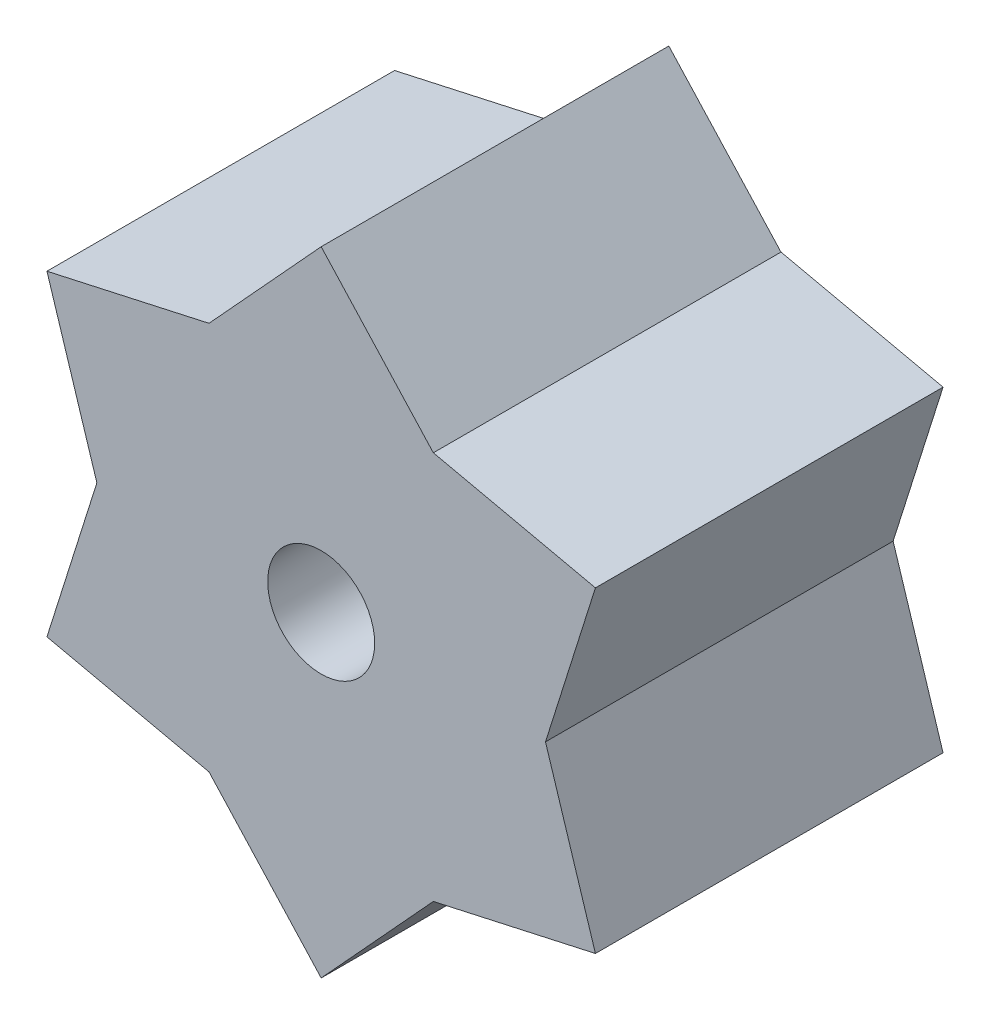
from build123d import *

# Parameters (mm, degrees)
SKETCH1_R           = 1
BOSS_EXTRUDE1_DEPTH = 6.5


with BuildPart() as part:
    # Sketch1 → Boss-Extrude1 (new body)
    with BuildSketch(Plane.XY):
        Polygon((0, -5.920748932), (2.09705825, -3.632211436), (5.127518984, -2.960374466), (4.194116501, 0), (5.127518984, 2.960374466), (2.09705825, 3.632211436), (0, 5.920748932), (-2.09705825, 3.632211436), (-5.127518984, 2.960374466), (-4.194116501, 0), (-5.127518984, -2.960374466), (-2.09705825, -3.632211436), align=None)
        Circle(SKETCH1_R, mode=Mode.SUBTRACT)
    extrude(amount=-BOSS_EXTRUDE1_DEPTH)


solid = part.part
